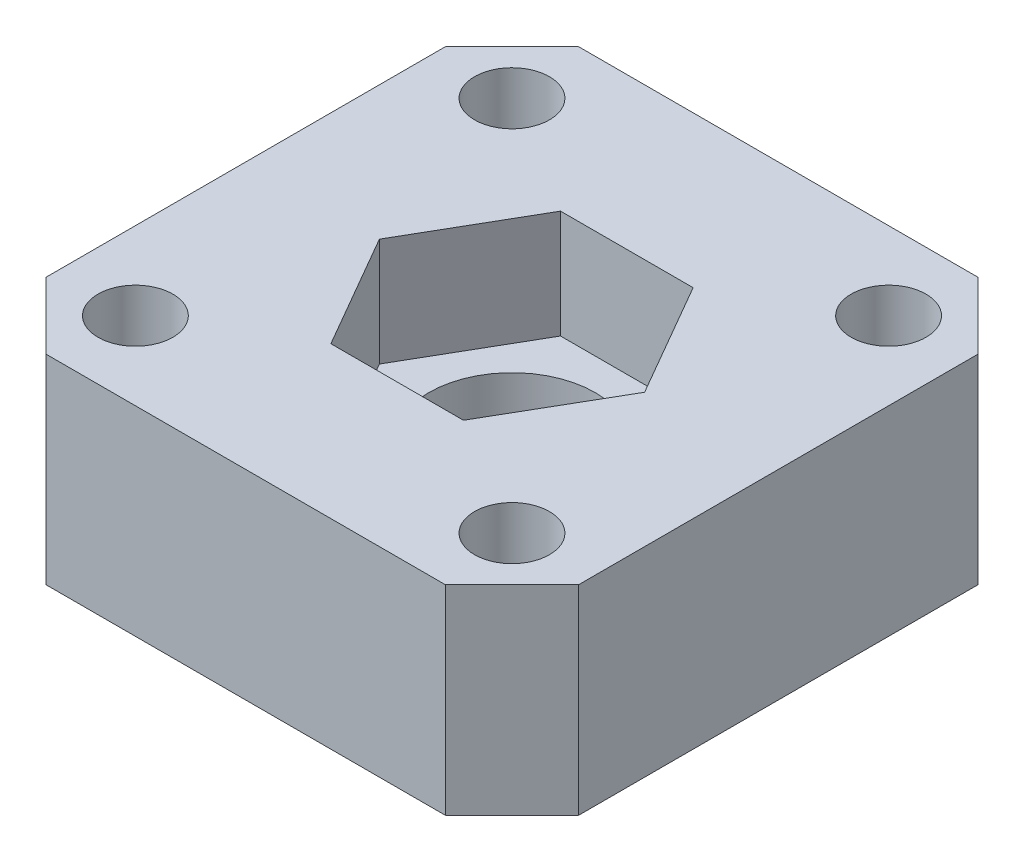
from build123d import *

# Parameters (mm, degrees)
SKETCH1_W           = 32
SKETCH1_H           = 32
SKETCH1_R           = 5
SKETCH1_R_2         = 2.25
BOSS_EXTRUDE1_DEPTH = 12
CHAMFER1_SIZE       = 4
CUT_EXTRUDE1_DEPTH  = 6.5


with BuildPart() as part:
    # Sketch1 → Boss-Extrude1 (new body)
    with BuildSketch(Plane(origin=(0, 0, 0), x_dir=(1, 0, 0), z_dir=(0, 1, 0))):
        Rectangle(SKETCH1_W, SKETCH1_H)
        with Locations(Location((0, 0, 0), (0, 0, 270))):
            Circle(SKETCH1_R, mode=Mode.SUBTRACT)
        with Locations(Location((-11.313708499, 11.313708499, 0), (0, 0, 270))):
            Circle(SKETCH1_R_2, mode=Mode.SUBTRACT)
        with Locations(Location((-11.313708499, -11.313708499, 0), (0, 0, 270))):
            Circle(SKETCH1_R_2, mode=Mode.SUBTRACT)
        with Locations(Location((11.313708499, -11.313708499, 0), (0, 0, 270))):
            Circle(SKETCH1_R_2, mode=Mode.SUBTRACT)
        with Locations(Location((11.313708499, 11.313708499, 0), (0, 0, 270))):
            Circle(SKETCH1_R_2, mode=Mode.SUBTRACT)
    extrude(amount=BOSS_EXTRUDE1_DEPTH)

    # Chamfer1
    chamfer1_edges = [part.edges().sort_by_distance(p)[0] for p in [
        (16, 6, 16),
        (-16, 6, 16),
        (-16, 6, -16),
        (16, 6, -16),
    ]]
    chamfer(chamfer1_edges, length=CHAMFER1_SIZE)

    # Sketch4 → Cut-Extrude1 (cut)
    with BuildSketch(Plane(origin=(0, 12, 0), x_dir=(1, 0, 0), z_dir=(0, 1, 0))):
        Polygon((3.983716857, -6.9), (7.967433715, 0), (3.983716857, 6.9), (-3.983716857, 6.9), (-7.967433715, 0), (-3.983716857, -6.9), align=None)
    extrude(amount=-CUT_EXTRUDE1_DEPTH, mode=Mode.SUBTRACT)


solid = part.part
